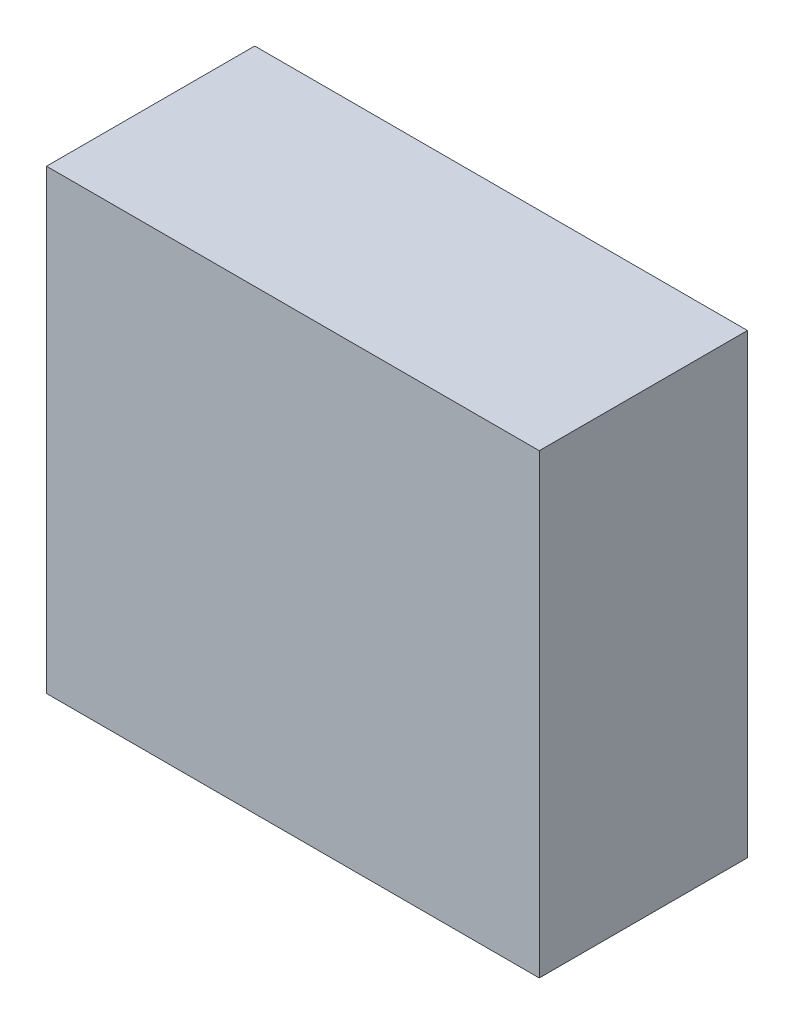
from build123d import *

# Parameters (mm, degrees)
SKETCH1_W           = 180.34
SKETCH1_H           = 167.132
BOSS_EXTRUDE1_DEPTH = 38.1


with BuildPart() as part:
    # Sketch1 → Boss-Extrude1 (new, symmetric)
    with BuildSketch(Plane.XY):
        Rectangle(SKETCH1_W, SKETCH1_H)
    extrude(amount=BOSS_EXTRUDE1_DEPTH, both=True)


solid = part.part
